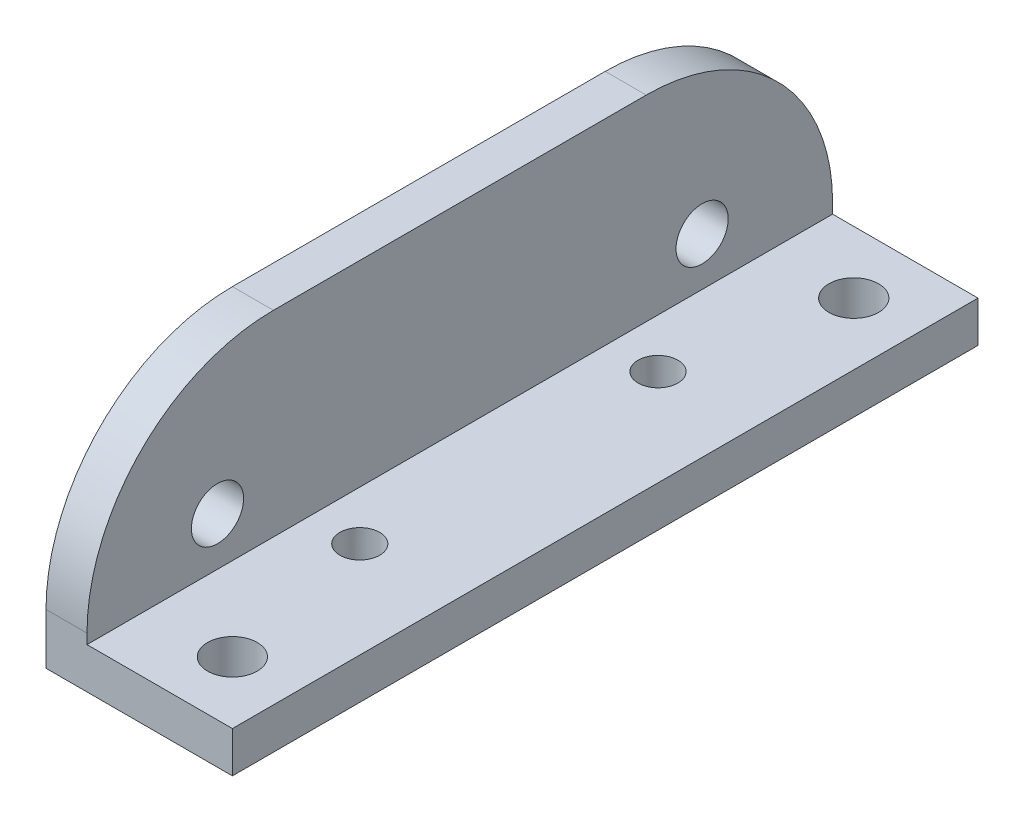
from build123d import *

# Parameters (mm, degrees)
EXTRUDE1_DEPTH               = 30
SKETCH2_W                    = 4.1
SKETCH2_H                    = 60
CUT_FOR_WALKER_CHASSIS_DEPTH = 41.368552117
F_4_2_4_2_DIAMETER_HOLE1_D   = 4.2
M4X0_7_TAPPED_HOLE1_D        = 4
SKETCH7_R                    = 1.6
CUT_EXTRUDE1_DEPTH           = 39.598056946
CUT_EXTRUDE_2_DEPTH          = 10


with BuildPart() as part:
    # Sketch1 → Extrude1 (new, symmetric)
    with BuildSketch(Plane.XY):
        Polygon((0, 0), (0, 19.1), (3.3, 19.1), (3.3, 3.3), (19.1, 3.3), (19.1, 0), align=None)
    extrude(amount=EXTRUDE1_DEPTH, both=True)

    # Sketch2 → Cut for walker chassis (cut, through all)
    with BuildSketch(Plane.XZ):
        with Locations((17.05, 0)):
            Rectangle(SKETCH2_W, SKETCH2_H)
    extrude(amount=-CUT_FOR_WALKER_CHASSIS_DEPTH, mode=Mode.SUBTRACT)

    # Ø4.2 (4.2) Diameter Hole1 (through all)
    with Locations(Plane.ZY):
        with Locations((-19.5, 7.18), (19.5, 7.18)):
            Hole(F_4_2_4_2_DIAMETER_HOLE1_D / 2)

    # M4x0.7 Tapped Hole1 (through all)
    with Locations(Plane.XZ):
        with Locations((10, 25), (10, -25)):
            Hole(M4X0_7_TAPPED_HOLE1_D / 2)

    # Sketch7 → Cut-Extrude1 (cut, through all)
    with BuildSketch(Plane.XZ):
        with Locations((7.25, -12)):
            Circle(SKETCH7_R)
        with Locations((7.25, 12)):
            Circle(SKETCH7_R)
    extrude(amount=-CUT_EXTRUDE1_DEPTH, mode=Mode.SUBTRACT)

    # Эскиз3 → Вырез-Вытянуть2 (cut)
    with BuildSketch(Plane(origin=(0, 0, 0), x_dir=(0, 0, -1), z_dir=(1, 0, 0))):
        with BuildLine():
            Line((-30, 19.1), (-30, 4.1))
            ThreePointArc((-30, 4.1), (-25.606601718, 14.706601718), (-15, 19.1))
            Line((-15, 19.1), (-30, 19.1))
        make_face()
    cut_extrude_2 = extrude(amount=CUT_EXTRUDE_2_DEPTH, mode=Mode.SUBTRACT)

    # Зеркальное отражение1: Вырез-Вытянуть2 across plane
    add(cut_extrude_2.mirror(Plane.XY), mode=Mode.SUBTRACT)


solid = part.part
